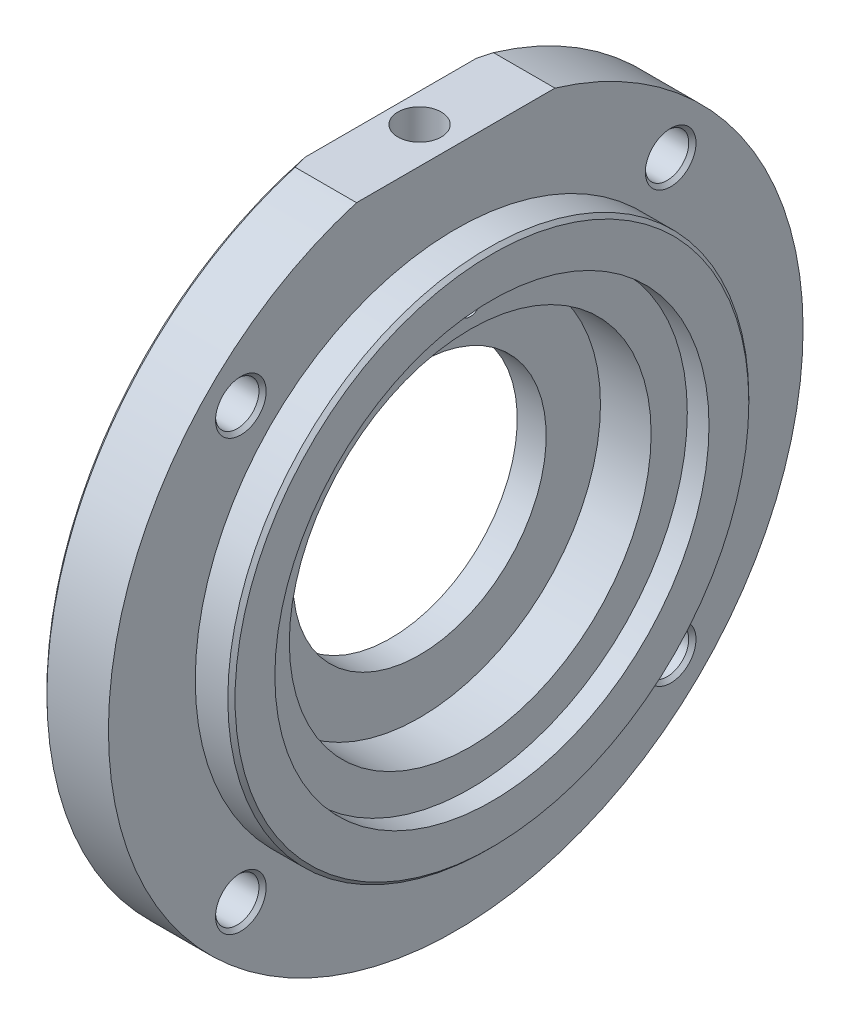
from build123d import *

# Parameters (mm, degrees)
CHAMFER1_SIZE                = 0.5
CHAMFER2_SIZE                = 0.5
CUT_EXTRUDE1_DEPTH           = 69.614867194
CUT_EXTRUDE1_DEPTH_BACK      = 69.614867194
SKETCH2_W                    = 53.497574986
SKETCH2_H                    = 37.646338773
CUT_EXTRUDE2_DEPTH           = 107.018866246
CUT_EXTRUDE2_DEPTH_BACK      = 7
SKETCH6_R                    = 3
F_3_0MM_DOWEL_HOLE1_D        = 3
F_3_0MM_DOWEL_HOLE1_DEPTH    = 12
F_3_0MM_DOWEL_HOLE1_TIP      = 0.901290929
F_3_0MM_DOWEL_HOLE2_D        = 3
F_3_0MM_DOWEL_HOLE2_DEPTH    = 10
F_3_0MM_DOWEL_HOLE2_TIP      = 0.901290929
CHAMFER3_SIZE                = 0.5
CIRPATTERN1_COUNT            = 4
CHAMFER3_OF_CIRPATTERN1_SIZE = 0.5


with BuildPart() as part:
    # Sketch1 → Revolve1 (revolve)
    with BuildSketch(Plane.XY, mode=Mode.PRIVATE) as revolve1_sk:
        Polygon((-4, -48), (-4, -17.5), (0, -17.5), (0, -25), (7, -25), (7, -30), (10, -30), (10, -36), (5, -36), (5, -48), align=None)
    revolve(revolve1_sk.sketch.rotate(Axis((-17.283695642, 0, 0), (1, 0, 0)), 270), axis=Axis((-17.283695642, 0, 0), (1, 0, 0)))

    # Chamfer1
    chamfer1_edges = [part.edges().sort_by_distance(p)[0] for p in [
        (-4, 0, -48),
    ]]
    chamfer(chamfer1_edges, length=CHAMFER1_SIZE)

    # Chamfer2
    chamfer2_edges = [part.edges().sort_by_distance(p)[0] for p in [
        (10, 0, -36),
    ]]
    chamfer(chamfer2_edges, length=CHAMFER2_SIZE)

    # Sketch2 → Cut-Extrude1 (cut, two sides: drawn at the far end of the back side and taken through both)
    with BuildSketch(Plane(origin=(0, 0, 0), x_dir=(0, 0, -1), z_dir=(1, 0, 0)).offset(-CUT_EXTRUDE1_DEPTH_BACK)):
        with Locations((0, 64.823169387)):
            Rectangle(SKETCH2_W, SKETCH2_H)
    extrude(amount=CUT_EXTRUDE1_DEPTH + CUT_EXTRUDE1_DEPTH_BACK, mode=Mode.SUBTRACT)

    # Sketch6 → Cut-Extrude2 (cut, two sides: drawn at the far end of the back side and taken through both)
    with BuildSketch(Plane(origin=(0, 46, 0), x_dir=(1, 0, 0), z_dir=(0, 1, 0)).offset(-CUT_EXTRUDE2_DEPTH_BACK)):
        with Locations(Location((0, 0, 0), (0, 0, 90))):
            Circle(SKETCH6_R)
    extrude(amount=CUT_EXTRUDE2_DEPTH + CUT_EXTRUDE2_DEPTH_BACK, mode=Mode.SUBTRACT)

    # Ø3.0mm Dowel Hole1
    with Locations(Plane(origin=(0, 39, 0), x_dir=(1, 0, 0), z_dir=(0, 1, 0))):
        with Locations((0, 0)):
            Hole(F_3_0MM_DOWEL_HOLE1_D / 2, depth=F_3_0MM_DOWEL_HOLE1_DEPTH)
            with Locations((0, 0, -(F_3_0MM_DOWEL_HOLE1_DEPTH + F_3_0MM_DOWEL_HOLE1_TIP / 2))):  # 118° drill point
                Cone(0, F_3_0MM_DOWEL_HOLE1_D / 2, F_3_0MM_DOWEL_HOLE1_TIP, mode=Mode.SUBTRACT)

    # Ø3.0mm Dowel Hole2
    with Locations(Plane(origin=(10, 0, 0), x_dir=(0, 0, -1), z_dir=(1, 0, 0))):
        with Locations((0, 28)):
            Hole(F_3_0MM_DOWEL_HOLE2_D / 2, depth=F_3_0MM_DOWEL_HOLE2_DEPTH)
            with Locations((0, 0, -(F_3_0MM_DOWEL_HOLE2_DEPTH + F_3_0MM_DOWEL_HOLE2_TIP / 2))):  # 118° drill point
                Cone(0, F_3_0MM_DOWEL_HOLE2_D / 2, F_3_0MM_DOWEL_HOLE2_TIP, mode=Mode.SUBTRACT)

    # Sketch15 → Ø6.0mm Dowel Hole2 (revolve, cut)
    with BuildSketch(Plane(origin=(5, 29.69848481, 29.69848481), x_dir=(0, 0, -1), z_dir=(0, 1, 0))):
        Polygon((0, 0), (0, 13.802581857), (3, 12), (3, 0), align=None)
    f_6_0mm_dowel_hole2 = revolve(axis=Axis((11.35, 29.69848481, 29.69848481), (-1, 0, 0)), mode=Mode.SUBTRACT)

    # Chamfer3
    chamfer3_edges = [part.edges().sort_by_distance(p)[0] for p in [
        (5, 29.69848481, 32.69848481),
    ]]
    chamfer(chamfer3_edges, length=CHAMFER3_SIZE)

    # CirPattern1: Ø6.0mm Dowel Hole2 ×4 about axis
    cirpattern1_axis = Axis((0, 0, 0), (1, 0, 0))
    for i in range(1, CIRPATTERN1_COUNT):
        add(f_6_0mm_dowel_hole2.rotate(cirpattern1_axis, i * 360 / CIRPATTERN1_COUNT), mode=Mode.SUBTRACT)

    # Chamfer3 of CirPattern1
    chamfer3_of_cirpattern1_edges = [part.edges().sort_by_distance(p)[0] for p in [
        (5, -32.69848481, 29.69848481),
        (5, -29.69848481, -32.69848481),
        (5, 32.69848481, -29.69848481),
    ]]
    chamfer(chamfer3_of_cirpattern1_edges, length=CHAMFER3_OF_CIRPATTERN1_SIZE)


solid = part.part
